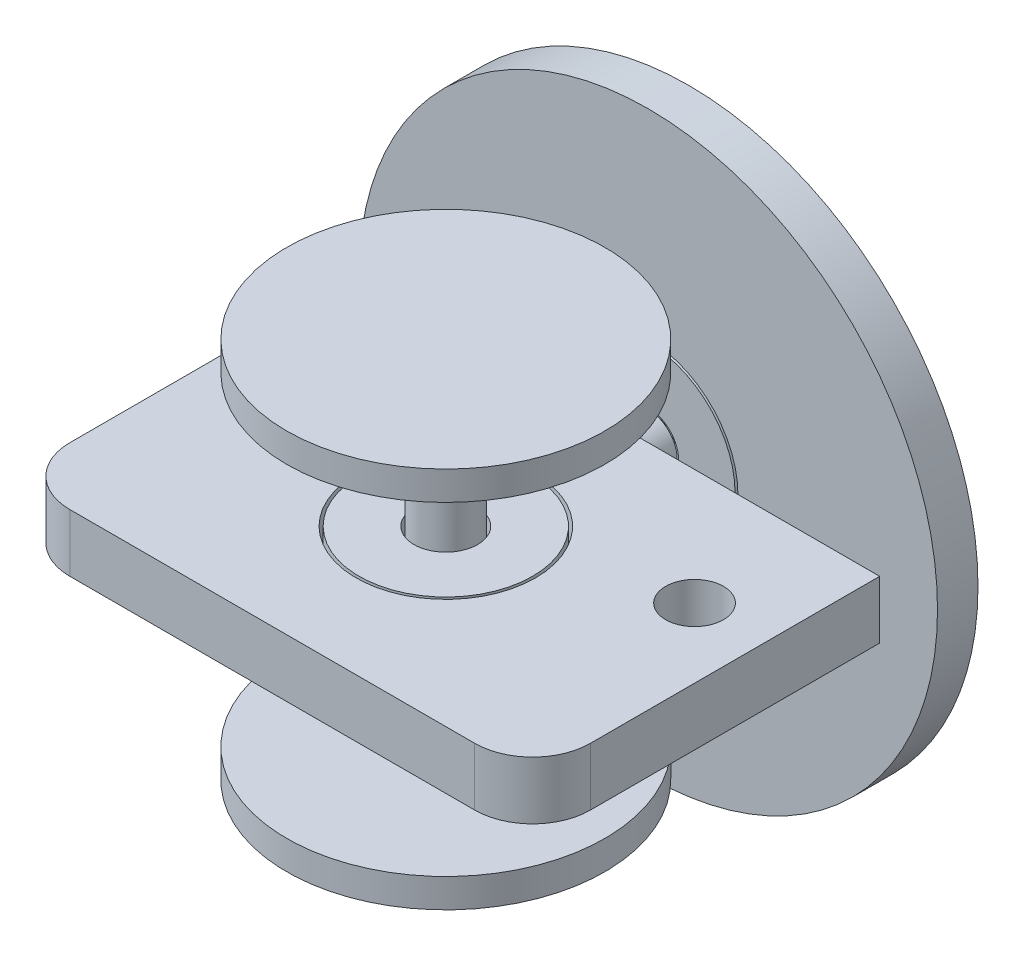
from build123d import *

# Parameters (mm, degrees)
SKETCH1_R                = 20
BOSS_EXTRUDE1_DEPTH      = 5
SKETCH3_R                = 1.5
CUT_EXTRUDE1_DEPTH       = 5
SKETCH4_R                = 5
BOSS_EXTRUDE2_DEPTH      = 15
BOSS_EXTRUDE3_START      = 3
SKETCH5_R                = 15
BOSS_EXTRUDE3_DEPTH      = 7
CUT_EXTRUDE4_START       = 3
SKETCH6_R                = 5.25
CUT_EXTRUDE4_DEPTH       = 7
SKETCH7_R                = 50
SKETCH7_R_2              = 15.5
BOSS_EXTRUDE4_DEPTH      = 7
SKETCH8_W                = 90
SKETCH8_H                = 10
BOSS_EXTRUDE5_DEPTH      = 60
SKETCH9_R                = 15.5
CUT_EXTRUDE5_DEPTH       = 10
SKETCH10_R               = 15
SKETCH10_R_2             = 5.5
BOSS_EXTRUDE6_DEPTH      = 10
FILLET1_R                = 10
BOSS_EXTRUDE7_DEPTH      = 3
BOSS_EXTRUDE7_DEPTH_BACK = 33
SKETCH11_R               = 5
SKETCH13_R               = 20
BOSS_EXTRUDE8_DEPTH      = 5
SKETCH14_R               = 1.5
CUT_EXTRUDE6_DEPTH       = 5
CIRPATTERN2_COUNT        = 24
SKETCH16_R               = 5
BOSS_EXTRUDE9_DEPTH      = 15
SKETCH18_R               = 27.5
BOSS_EXTRUDE10_DEPTH     = 5
SKETCH19_R               = 27.5
BOSS_EXTRUDE11_DEPTH     = 5
SKETCH20_R               = 5
CUT_EXTRUDE7_DEPTH       = 10


with BuildPart() as part:
    # Sketch1 → Boss-Extrude1 (new body)
    with BuildSketch(Plane.XY):
        Circle(SKETCH1_R)
    extrude(amount=BOSS_EXTRUDE1_DEPTH)

    # Sketch3 → Cut-Extrude1 (cut)
    with BuildSketch(Plane.XY.offset(5)):
        with Locations((0, 20)):
            Circle(SKETCH3_R)
        with Locations((5.176380902, 19.318516526)):
            Circle(SKETCH3_R)
        with Locations((10, 17.320508076)):
            Circle(SKETCH3_R)
        with Locations((14.142135624, 14.142135624)):
            Circle(SKETCH3_R)
        with Locations((17.320508076, 10)):
            Circle(SKETCH3_R)
        with Locations((19.318516526, 5.176380902)):
            Circle(SKETCH3_R)
        with Locations((20, 0)):
            Circle(SKETCH3_R)
        with Locations((19.318516526, -5.176380902)):
            Circle(SKETCH3_R)
        with Locations((17.320508076, -10)):
            Circle(SKETCH3_R)
        with Locations((14.142135624, -14.142135624)):
            Circle(SKETCH3_R)
        with Locations((10, -17.320508076)):
            Circle(SKETCH3_R)
        with Locations((5.176380902, -19.318516526)):
            Circle(SKETCH3_R)
        with Locations((0, -20)):
            Circle(SKETCH3_R)
        with Locations((-5.176380902, -19.318516526)):
            Circle(SKETCH3_R)
        with Locations((-10, -17.320508076)):
            Circle(SKETCH3_R)
        with Locations((-14.142135624, -14.142135624)):
            Circle(SKETCH3_R)
        with Locations((-17.320508076, -10)):
            Circle(SKETCH3_R)
        with Locations((-19.318516526, -5.176380902)):
            Circle(SKETCH3_R)
        with Locations((-20, 0)):
            Circle(SKETCH3_R)
        with Locations((-19.318516526, 5.176380902)):
            Circle(SKETCH3_R)
        with Locations((-17.320508076, 10)):
            Circle(SKETCH3_R)
        with Locations((-14.142135624, 14.142135624)):
            Circle(SKETCH3_R)
        with Locations((-10, 17.320508076)):
            Circle(SKETCH3_R)
        with Locations((-5.176380902, 19.318516526)):
            Circle(SKETCH3_R)
    extrude(amount=-CUT_EXTRUDE1_DEPTH, mode=Mode.SUBTRACT)

    # Sketch4 → Boss-Extrude2 (add)
    with BuildSketch(Plane.XY.offset(5)):
        Circle(SKETCH4_R)
    extrude(amount=BOSS_EXTRUDE2_DEPTH)

    # Sketch5 → Boss-Extrude3 (add)
    with BuildSketch(Plane.XY.offset(5).offset(BOSS_EXTRUDE3_START)):
        Circle(SKETCH5_R)
    extrude(amount=BOSS_EXTRUDE3_DEPTH)

    # Sketch6 → Cut-Extrude4 (cut)
    with BuildSketch(Plane.XY.offset(5).offset(CUT_EXTRUDE4_START)):
        Circle(SKETCH6_R)
    extrude(amount=CUT_EXTRUDE4_DEPTH, mode=Mode.SUBTRACT)


with BuildPart() as cut_extrude4_piece_1:
    # of the separate pieces the step leaves, piece 1, a body of its own (cut_extrude4_pieces)
    add(part.part.solids().sort_by_distance((19.94375, 1.498944941, 0))[0])


with BuildPart() as cut_extrude4_piece_2:
    # of the separate pieces the step leaves, piece 2, a body of its own (cut_extrude4_pieces)
    add(part.part.solids().sort_by_distance((15, 0, 8))[0])


with BuildPart() as cut_extrude4_piece_3:
    # of the separate pieces the step leaves, piece 3, a body of its own (cut_extrude4_pieces)
    add(part.part.solids().sort_by_distance((5, 0, 15))[0])

    # Sketch8 → Boss-Extrude5 (add)
    with BuildSketch(Plane.XY.offset(20)):
        Rectangle(SKETCH8_W, SKETCH8_H)
    extrude(amount=BOSS_EXTRUDE5_DEPTH)

    # Sketch9 → Cut-Extrude5 (cut)
    with BuildSketch(Plane.XZ.offset(5)):
        with Locations(Location((0, 50, 0), (0, 0, 270))):
            Circle(SKETCH9_R)
    extrude(amount=-CUT_EXTRUDE5_DEPTH, mode=Mode.SUBTRACT)

    # Fillet1
    fillet1_edges = [cut_extrude4_piece_3.edges().sort_by_distance(p)[0] for p in [
        (45, 0, 80),
        (-45, 0, 80),
    ]]
    fillet(fillet1_edges, radius=FILLET1_R)

    # Sketch20 → Cut-Extrude7 (cut)
    with BuildSketch(Plane(origin=(0, 5, 0), x_dir=(1, 0, 0), z_dir=(0, 1, 0))):
        with Locations(Location((33, -40, 0), (0, 0, 180))):
            Circle(SKETCH20_R)
    extrude(amount=-CUT_EXTRUDE7_DEPTH, mode=Mode.SUBTRACT)


with BuildPart() as body_4:
    # Sketch7 → Boss-Extrude4 (new body)
    with BuildSketch(Plane.XY.offset(15)):
        Circle(SKETCH7_R)
        Circle(SKETCH7_R_2, mode=Mode.SUBTRACT)
    extrude(amount=-BOSS_EXTRUDE4_DEPTH)


with BuildPart() as body_5:
    # Sketch10 → Boss-Extrude6 (new body)
    with BuildSketch(Plane.XZ.offset(5)):
        with Locations(Location((0, 50, 0), (0, 0, 270))):
            Circle(SKETCH10_R)
        with Locations(Location((0, 50, 0), (0, 0, 270))):
            Circle(SKETCH10_R_2, mode=Mode.SUBTRACT)
    extrude(amount=-BOSS_EXTRUDE6_DEPTH)


with BuildPart() as body_6:
    # Sketch11 → Boss-Extrude7 (new, two sides: drawn at the far end of the back side and taken through both)
    with BuildSketch(Plane(origin=(0, -5, 0), x_dir=(-1, 0, 0), z_dir=(0, -1, 0)).offset(-BOSS_EXTRUDE7_DEPTH_BACK)):
        with Locations(Location((0, -50, 0), (0, 0, 90))):
            Circle(SKETCH11_R)
    extrude(amount=BOSS_EXTRUDE7_DEPTH + BOSS_EXTRUDE7_DEPTH_BACK)

    # Sketch13 → Boss-Extrude8 (add)
    with BuildSketch(Plane.XZ.offset(8)):
        with Locations(Location((0, 50, 0), (0, 0, 270))):
            Circle(SKETCH13_R)
    extrude(amount=BOSS_EXTRUDE8_DEPTH)

    # Sketch14 → Cut-Extrude6 (cut)
    with BuildSketch(Plane.XZ.offset(13)):
        with Locations((0, 70)):
            Circle(SKETCH14_R)
    cut_extrude6 = extrude(amount=-CUT_EXTRUDE6_DEPTH, mode=Mode.SUBTRACT)

    # CirPattern2: Cut-Extrude6 ×24 about axis
    cirpattern2_axis = Axis((0, 0, 50), (0, 1, 0))
    for i in range(1, CIRPATTERN2_COUNT):
        add(cut_extrude6.rotate(cirpattern2_axis, i * 360 / CIRPATTERN2_COUNT), mode=Mode.SUBTRACT)

    # Sketch16 → Boss-Extrude9 (add)
    with BuildSketch(Plane.XZ.offset(13)):
        with Locations(Location((0, 50, 0), (0, 0, 270))):
            Circle(SKETCH16_R)
    extrude(amount=BOSS_EXTRUDE9_DEPTH)

    # Sketch18 → Boss-Extrude10 (add)
    with BuildSketch(Plane.XZ.offset(28)):
        with Locations(Location((0, 50, 0), (0, 0, 270))):
            Circle(SKETCH18_R)
    extrude(amount=BOSS_EXTRUDE10_DEPTH)

    # Sketch19 → Boss-Extrude11 (add)
    with BuildSketch(Plane(origin=(0, 28, 0), x_dir=(1, 0, 0), z_dir=(0, 1, 0))):
        with Locations(Location((0, -50, 0), (0, 0, 90))):
            Circle(SKETCH19_R)
    extrude(amount=BOSS_EXTRUDE11_DEPTH)


solid = Compound([cut_extrude4_piece_1.part, cut_extrude4_piece_2.part, cut_extrude4_piece_3.part, body_4.part, body_5.part, body_6.part])
